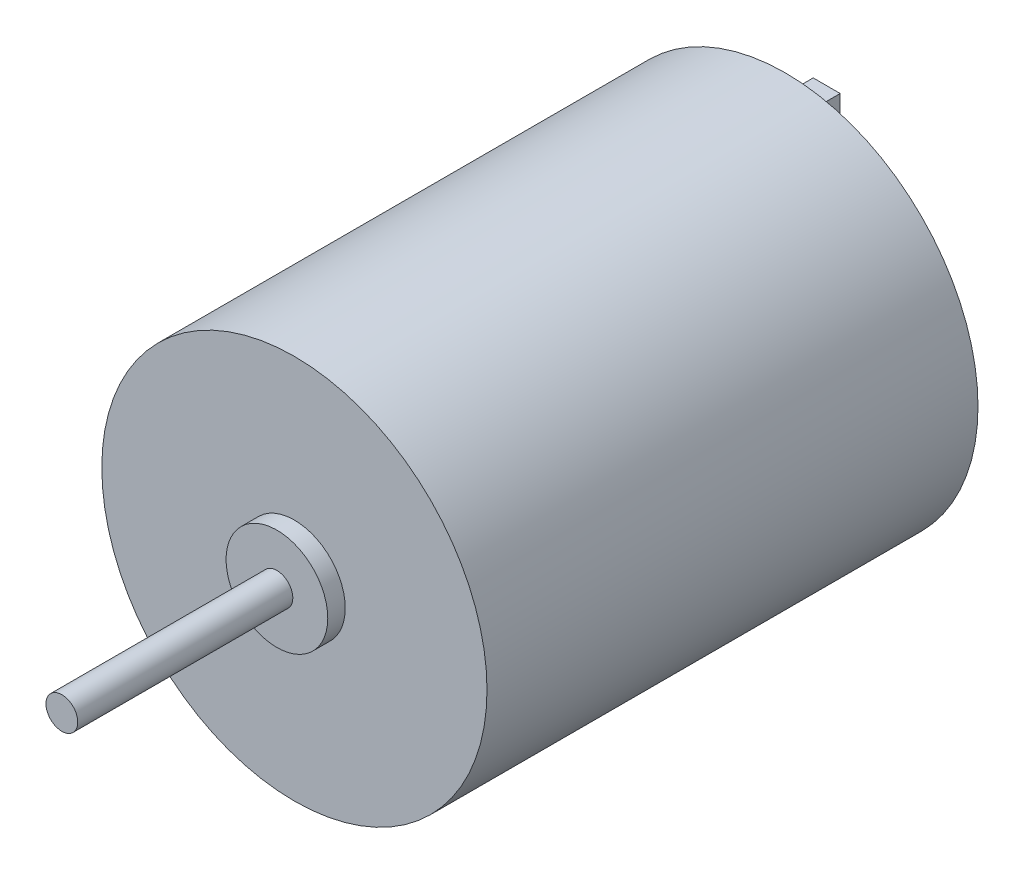
from build123d import *

# Parameters (mm, degrees)
ESQUISSE1_R        = 12.125
BOSS_EXTRU_1_DEPTH = 30.91
ESQUISSE2_R        = 3.2
BOSS_EXTRU_2_DEPTH = 1.1
ESQUISSE3_R        = 1
BOSS_EXTRU_3_DEPTH = 13.54
ESQUISSE9_W        = 1.7
ESQUISSE9_H        = 1.7
BOSS_EXTRU_6_DEPTH = 2.6


with BuildPart() as part:
    # Esquisse1 → Boss.-Extru.1 (new body)
    with BuildSketch(Plane.XY):
        with Locations(Location((0, 0, 0), (0, 0, 180))):
            Circle(ESQUISSE1_R)
    extrude(amount=BOSS_EXTRU_1_DEPTH)

    # Esquisse2 → Boss.-Extru.2 (add)
    with BuildSketch(Plane.XY.offset(30.91)):
        Circle(ESQUISSE2_R)
    extrude(amount=BOSS_EXTRU_2_DEPTH)

    # Esquisse3 → Boss.-Extru.3 (add)
    with BuildSketch(Plane.XY.offset(32.01)):
        Circle(ESQUISSE3_R)
    extrude(amount=BOSS_EXTRU_3_DEPTH)

    # Esquisse9 → Boss.-Extru.6 (add)
    with BuildSketch(Plane(origin=(0, 0, 0), x_dir=(-1, 0, 0), z_dir=(0, 0, -1))):
        with Locations((0, -9.275)):
            Rectangle(ESQUISSE9_W, ESQUISSE9_H)
        with Locations((0, 9.275)):
            Rectangle(ESQUISSE9_W, ESQUISSE9_H)
    extrude(amount=BOSS_EXTRU_6_DEPTH)


solid = part.part
